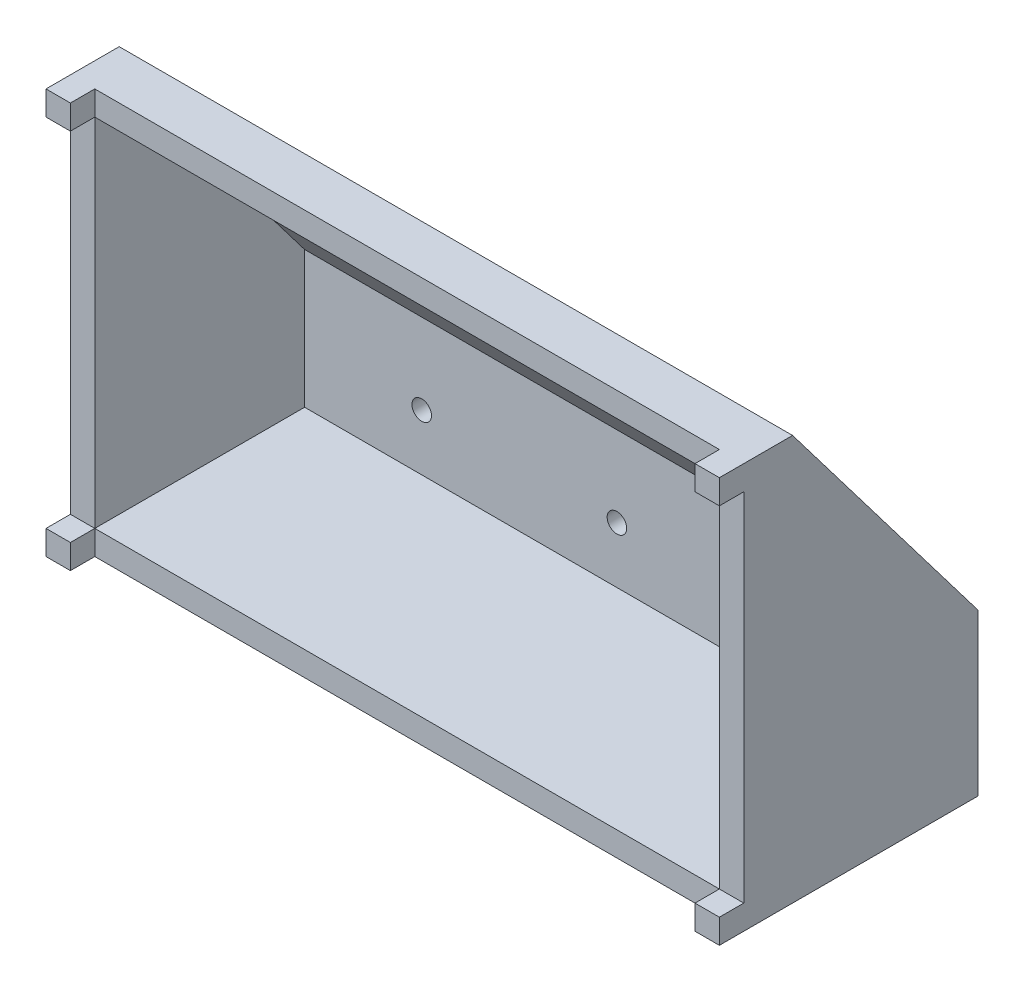
from build123d import *

# Parameters (mm, degrees)
SKETCH1_W           = 138
SKETCH1_H           = 83
SKETCH1_W_2         = 128
SKETCH1_H_2         = 73
BOSS_EXTRUDE1_DEPTH = 10
SKETCH2_W           = 5
SKETCH2_H           = 5
BOSS_EXTRUDE2_DEPTH = 5
SKETCH3_W           = 138
SKETCH3_H           = 5
BOSS_EXTRUDE3_DEPTH = 38
SKETCH6_W           = 138
SKETCH6_H           = 28
BOSS_EXTRUDE4_DEPTH = 5
BOSS_EXTRUDE5_DEPTH = 138
BOSS_EXTRUDE6_DEPTH = 5
BOSS_EXTRUDE7_DEPTH = 5
CUT_EXTRUDE1_REACH  = 97.915
SKETCH14_W          = 51
SKETCH14_H          = 20
SKETCH16_W          = 15
SKETCH16_H          = 13
CUT_EXTRUDE2_DEPTH  = 2
CUT_EXTRUDE3_REACH  = 96.631
SKETCH17_W          = 3
SKETCH17_H          = 13
SKETCH18_R          = 1
CUT_EXTRUDE4_DEPTH  = 3.5
CUT_EXTRUDE5_REACH  = 98.396
SKETCH19_R          = 2
SKETCH20_W          = 15
SKETCH20_H          = 4
CUT_EXTRUDE6_DEPTH  = 3


with BuildPart() as part:
    # Sketch1 → Boss-Extrude1 (new body)
    with BuildSketch(Plane.XY):
        Rectangle(SKETCH1_W, SKETCH1_H)
        Rectangle(SKETCH1_W_2, SKETCH1_H_2, mode=Mode.SUBTRACT)
    extrude(amount=BOSS_EXTRUDE1_DEPTH)

    # Sketch2 → Boss-Extrude2 (add)
    with BuildSketch(Plane.XY.offset(10)):
        with Locations((66.5, 39)):
            Rectangle(SKETCH2_W, SKETCH2_H)
        with Locations((66.5, -39)):
            Rectangle(SKETCH2_W, SKETCH2_H)
        with Locations((-66.5, -39)):
            Rectangle(SKETCH2_W, SKETCH2_H)
        with Locations((-66.5, 39)):
            Rectangle(SKETCH2_W, SKETCH2_H)
    extrude(amount=BOSS_EXTRUDE2_DEPTH)

    # Sketch3 → Boss-Extrude3 (add)
    with BuildSketch(Plane(origin=(0, 0, 0), x_dir=(-1, 0, 0), z_dir=(0, 0, -1))):
        with Locations((0, -39)):
            Rectangle(SKETCH3_W, SKETCH3_H)
    extrude(amount=BOSS_EXTRUDE3_DEPTH)

    # Sketch6 → Boss-Extrude4 (add)
    with BuildSketch(Plane.XY.offset(-38)):
        with Locations((0, -22.5)):
            Rectangle(SKETCH6_W, SKETCH6_H)
    extrude(amount=BOSS_EXTRUDE4_DEPTH)

    # Sketch8 → Boss-Extrude5 (add, through all)
    with BuildSketch(Plane(origin=(69, 0, 0), x_dir=(0, 0, -1), z_dir=(1, 0, 0))):
        Polygon((0, 41.5), (38, -8.5), (33, -8.5), (-5, 41.5), align=None)
    extrude(amount=-BOSS_EXTRUDE5_DEPTH)

    # Sketch9 → Boss-Extrude6 (add)
    with BuildSketch(Plane(origin=(69, 0, 0), x_dir=(0, 0, -1), z_dir=(1, 0, 0))):
        Polygon((0, 34.921052632), (33, -8.5), (33, -36.5), (0, -36.5), align=None)
    extrude(amount=-BOSS_EXTRUDE6_DEPTH)

    # Sketch10 → Boss-Extrude7 (add)
    with BuildSketch(Plane.ZY.offset(69)):
        Polygon((0, 34.921052632), (0, -36.5), (-33, -36.5), (-33, -8.5), align=None)
    extrude(amount=-BOSS_EXTRUDE7_DEPTH)

    # Sketch14 → Cut-Extrude1 (cut, up to next)
    with BuildSketch(Plane(origin=(0, 15.194219067, -19.992393509), x_dir=(-1, 0, 0), z_dir=(0, 0.6050832675335605, -0.7961621941231005)), mode=Mode.PRIVATE) as cut_extrude1_sk1:
        with Locations((-26.994700685, 1.64009412)):
            Rectangle(SKETCH14_W, SKETCH14_H)
    cut_extrude1_tool1 = extrude(cut_extrude1_sk1.sketch, amount=-CUT_EXTRUDE1_REACH, mode=Mode.PRIVATE) & part.part
    add(cut_extrude1_tool1.solids().sort_by_distance((26.994701, 16.5, -19))[0], mode=Mode.SUBTRACT)

    # Sketch16 → Cut-Extrude2 (cut)
    with BuildSketch(Plane(origin=(0, 15.194219067, -19.992393509), x_dir=(-1, 0, 0), z_dir=(0, 0.6050832675335606, -0.7961621941231006))):
        with Locations((46.5, 1.64009412)):
            Rectangle(SKETCH16_W, SKETCH16_H)
    extrude(amount=-CUT_EXTRUDE2_DEPTH, mode=Mode.SUBTRACT)

    # Sketch17 → Cut-Extrude3 (cut, up to next)
    with BuildSketch(Plane(origin=(0, 13.984052532, -18.400069121), x_dir=(-1, 0, 0), z_dir=(0, 0.6050832675335606, -0.7961621941231006)), mode=Mode.PRIVATE) as cut_extrude3_sk1:
        with Locations((40.5, 1.64009412)):
            Rectangle(SKETCH17_W, SKETCH17_H)
    cut_extrude3_tool1 = extrude(cut_extrude3_sk1.sketch, amount=-CUT_EXTRUDE3_REACH, mode=Mode.PRIVATE) & part.part
    # Sketch17 → Cut-Extrude3 (cut, up to next)
    with BuildSketch(Plane(origin=(0, 13.984052532, -18.400069121), x_dir=(-1, 0, 0), z_dir=(0, 0.6050832675335606, -0.7961621941231006)), mode=Mode.PRIVATE) as cut_extrude3_sk2:
        with Locations((52.5, 1.64009412)):
            Rectangle(SKETCH17_W, SKETCH17_H)
    cut_extrude3_tool2 = extrude(cut_extrude3_sk2.sketch, amount=-CUT_EXTRUDE3_REACH, mode=Mode.PRIVATE) & part.part
    add(cut_extrude3_tool1.solids().sort_by_distance((-40.5, 15.289833, -17.407676))[0], mode=Mode.SUBTRACT)
    add(cut_extrude3_tool2.solids().sort_by_distance((-52.5, 15.289833, -17.407676))[0], mode=Mode.SUBTRACT)

    # Sketch18 → Cut-Extrude4 (cut)
    with BuildSketch(Plane(origin=(0, 12.785496957, -16.823022312), x_dir=(1, 0, 0), z_dir=(0, -0.6050832675335605, 0.7961621941231007))):
        with Locations(Location((49.194700685, -10.13990588, 0), (0, 0, 270))):
            Circle(SKETCH18_R)
        with Locations(Location((4.794700685, -10.13990588, 0), (0, 0, 270))):
            Circle(SKETCH18_R)
        with Locations(Location((4.794700685, 13.42009412, 0), (0, 0, 270))):
            Circle(SKETCH18_R)
        with Locations(Location((49.194700685, 13.42009412, 0), (0, 0, 270))):
            Circle(SKETCH18_R)
    extrude(amount=-CUT_EXTRUDE4_DEPTH, mode=Mode.SUBTRACT)

    # Sketch19 → Cut-Extrude5 (cut, up to next)
    with BuildSketch(Plane(origin=(0, 0, -38), x_dir=(-1, 0, 0), z_dir=(0, 0, -1)), mode=Mode.PRIVATE) as cut_extrude5_sk1:
        with Locations((40, -25)):
            Circle(SKETCH19_R)
    cut_extrude5_tool1 = extrude(cut_extrude5_sk1.sketch, amount=-CUT_EXTRUDE5_REACH, mode=Mode.PRIVATE) & part.part
    # Sketch19 → Cut-Extrude5 (cut, up to next)
    with BuildSketch(Plane(origin=(0, 0, -38), x_dir=(-1, 0, 0), z_dir=(0, 0, -1)), mode=Mode.PRIVATE) as cut_extrude5_sk2:
        with Locations((0, -25)):
            Circle(SKETCH19_R)
    cut_extrude5_tool2 = extrude(cut_extrude5_sk2.sketch, amount=-CUT_EXTRUDE5_REACH, mode=Mode.PRIVATE) & part.part
    # Sketch19 → Cut-Extrude5 (cut, up to next)
    with BuildSketch(Plane(origin=(0, 0, -38), x_dir=(-1, 0, 0), z_dir=(0, 0, -1)), mode=Mode.PRIVATE) as cut_extrude5_sk3:
        with Locations((-40, -25)):
            Circle(SKETCH19_R)
    cut_extrude5_tool3 = extrude(cut_extrude5_sk3.sketch, amount=-CUT_EXTRUDE5_REACH, mode=Mode.PRIVATE) & part.part
    add(cut_extrude5_tool1.solids().sort_by_distance((-40, -25, -38))[0], mode=Mode.SUBTRACT)
    add(cut_extrude5_tool2.solids().sort_by_distance((0, -25, -38))[0], mode=Mode.SUBTRACT)
    add(cut_extrude5_tool3.solids().sort_by_distance((40, -25, -38))[0], mode=Mode.SUBTRACT)

    # Sketch20 → Cut-Extrude6 (cut)
    with BuildSketch(Plane(origin=(0, 12.785496957, -16.823022312), x_dir=(1, 0, 0), z_dir=(0, -0.6050832675335605, 0.7961621941231007))):
        with Locations((26.994700685, -10.35990588)):
            Rectangle(SKETCH20_W, SKETCH20_H)
    extrude(amount=-CUT_EXTRUDE6_DEPTH, mode=Mode.SUBTRACT)


solid = part.part
